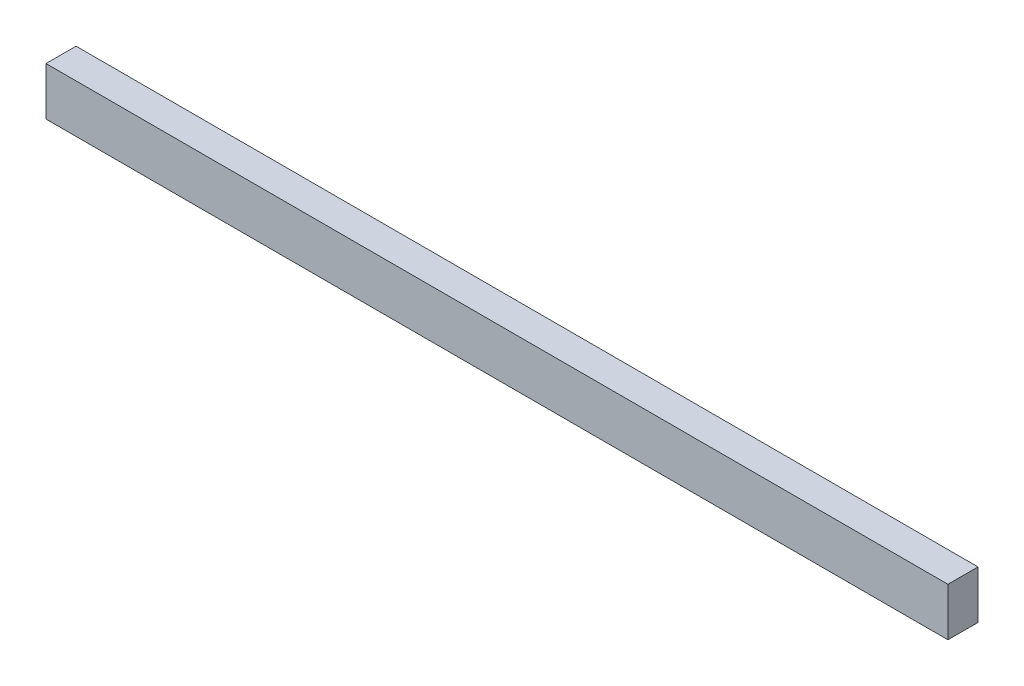
from build123d import *

# Parameters (mm, degrees)
ESQUISSE1_W        = 750
ESQUISSE1_H        = 40
BOSS_EXTRU_1_DEPTH = 25


with BuildPart() as part:
    # Esquisse1 → Boss.-Extru.1 (new body)
    with BuildSketch(Plane.XY):
        with Locations((375, 20)):
            Rectangle(ESQUISSE1_W, ESQUISSE1_H)
    extrude(amount=BOSS_EXTRU_1_DEPTH)


solid = part.part
